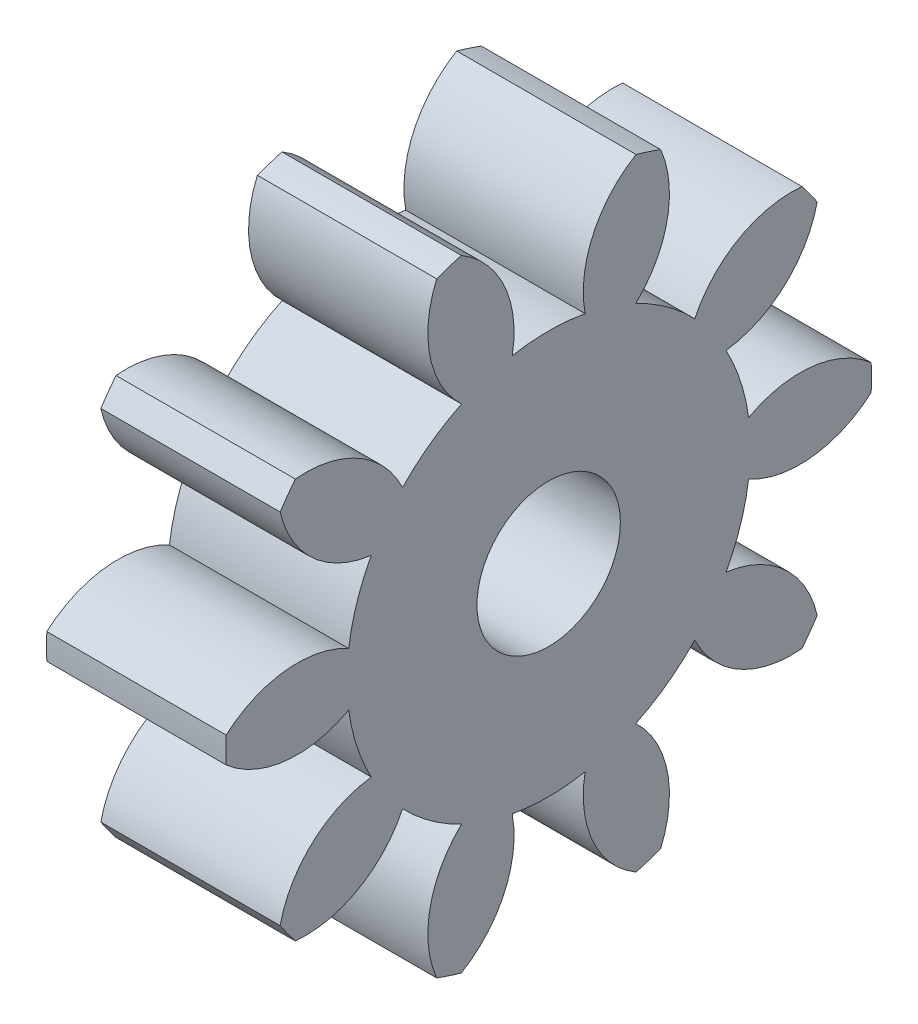
from build123d import *

# Parameters (mm, degrees)
BASPROSKE_W        = 5
BASPROSKE_H        = 9
TOOTHCUT_DEPTH     = 14.674794331
TEETHCUTS_COUNT    = 10
TEETHCUTS_ANGLE    = 324
BORSKE_R           = 1
BORE_DEPTH         = 50.0000508
SKETCH1_R          = 2
CUT_EXTRUDE1_DEPTH = 14.456084477


with BuildPart() as part:
    # BasProSke → Base-Revolve (revolve)
    with BuildSketch(Plane(origin=(0, 0, 0), x_dir=(1, 0, 0), z_dir=(0, 1, 0)), mode=Mode.PRIVATE) as base_revolve_sk:
        with Locations((2.5, 4.5)):
            Rectangle(BASPROSKE_W, BASPROSKE_H)
    revolve(base_revolve_sk.sketch.rotate(Axis((-10, 0, 0), (1, 0, 0)), 180), axis=Axis((-10, 0, 0), (1, 0, 0)))

    # TooCutSke → ToothCut (cut, through all)
    with BuildSketch(Plane(origin=(0, 0, 0), x_dir=(0, 0, -1), z_dir=(1, 0, 0))):
        with BuildLine():
            ThreePointArc((1.016107861, 5.531446539), (0, 5.624), (-1.016107861, 5.531446539))
            ThreePointArc((-1.016107861, 5.531446539), (-1.239855704, 7.337466374), (-2.46637752, 8.681867719))
            ThreePointArc((-2.46637752, 8.681867719), (0, 9.0254), (2.46637752, 8.681867719))
            ThreePointArc((2.46637752, 8.681867719), (1.239855704, 7.337466374), (1.016107861, 5.531446539))
        make_face()
    toothcut = extrude(amount=TOOTHCUT_DEPTH, mode=Mode.SUBTRACT)

    # TeethCuts: ToothCut ×10 about axis
    teethcuts_axis = Axis((-10, 0, 0), (1, 0, 0))
    for i in range(1, TEETHCUTS_COUNT):
        add(toothcut.rotate(teethcuts_axis, i * TEETHCUTS_ANGLE / (TEETHCUTS_COUNT - 1)), mode=Mode.SUBTRACT)

    # BorSke → Bore (cut, symmetric)
    with BuildSketch(Plane(origin=(0, 0, 0), x_dir=(0, 0, -1), z_dir=(1, 0, 0))):
        with Locations(Location((0, 0, 0), (0, 0, 180))):
            Circle(BORSKE_R)
    extrude(amount=BORE_DEPTH, both=True, mode=Mode.SUBTRACT)

    # Sketch1 → Cut-Extrude1 (cut, through all)
    with BuildSketch(Plane(origin=(5, 0, 0), x_dir=(0, 0, -1), z_dir=(1, 0, 0))):
        Circle(SKETCH1_R)
    extrude(amount=-CUT_EXTRUDE1_DEPTH, mode=Mode.SUBTRACT)


solid = part.part
